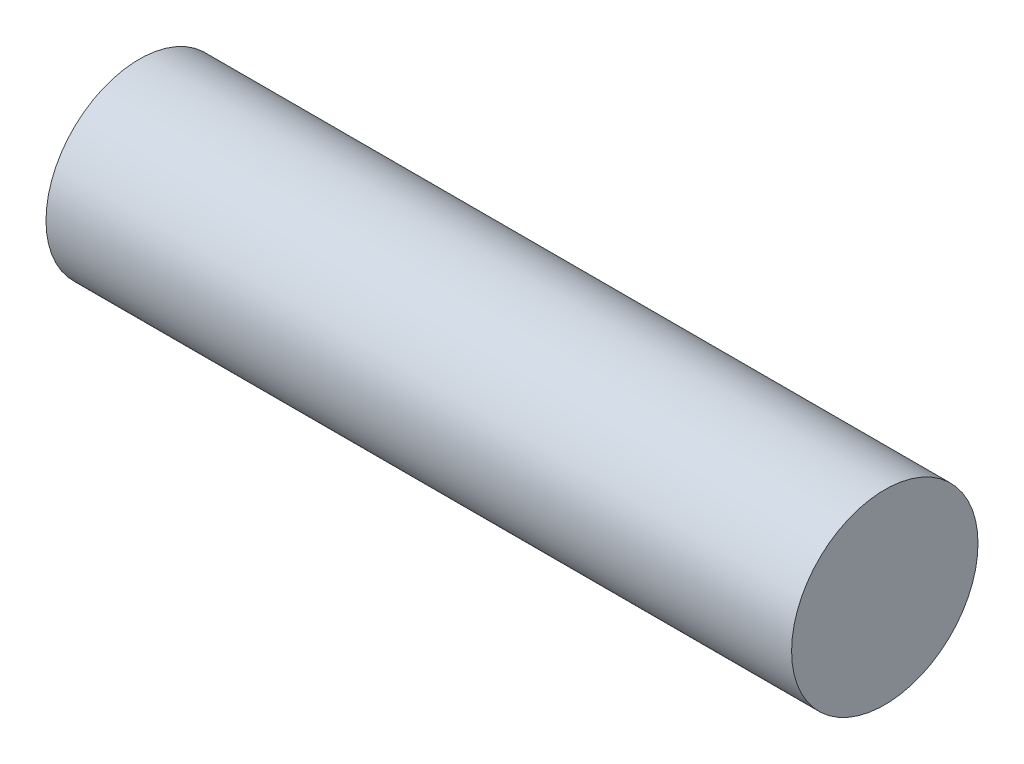
from build123d import *

# Parameters (mm, degrees)
SKETCH1_R           = 3.175
BOSS_EXTRUDE1_DEPTH = 25.4


with BuildPart() as part:
    # Sketch1 → Boss-Extrude1 (new body)
    with BuildSketch(Plane(origin=(0, 0, 0), x_dir=(0, 0, -1), z_dir=(1, 0, 0))):
        Circle(SKETCH1_R)
    extrude(amount=BOSS_EXTRUDE1_DEPTH)


solid = part.part
